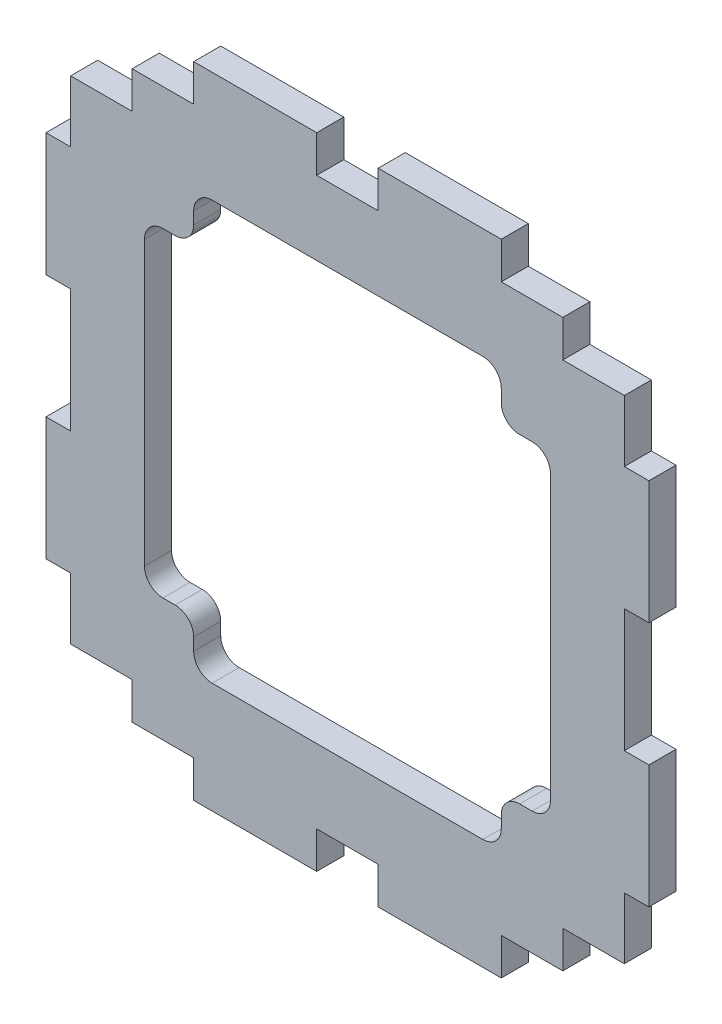
from build123d import *

# Parameters (mm, degrees)
EXTRUDE_1_DEPTH = 2.2


with BuildPart() as part:
    # Model → 凸台-拉伸1 (new body)
    with BuildSketch(Plane.XY):
        Polygon((-11.407474747, -25.191111111), (-11.407474747, -22.191111111), (-16.407474747, -22.191111111), (-16.407474747, -19.191111111), (-21.407474747, -19.191111111), (-21.407474747, -14.191111111), (-23.407474747, -14.191111111), (-23.407474747, -4.191111111), (-21.407474747, -4.191111111), (-21.407474747, 5.808888889), (-23.407474747, 5.808888889), (-23.407474747, 15.808888889), (-21.407474747, 15.808888889), (-21.407474747, 20.808888889), (-16.407474747, 20.808888889), (-16.407474747, 23.808888889), (-11.407474747, 23.808888889), (-11.407474747, 26.808888889), (-1.407474747, 26.808888889), (-1.407474747, 23.808888889), (3.592525253, 23.808888889), (3.592525253, 26.808888889), (13.592525253, 26.808888889), (13.592525253, 23.808888889), (18.592525253, 23.808888889), (18.592525253, 20.808888889), (23.592525253, 20.808888889), (23.592525253, 15.808888889), (25.592525253, 15.808888889), (25.592525253, 5.808888889), (23.592525253, 5.808888889), (23.592525253, -4.191111111), (25.592525253, -4.191111111), (25.592525253, -14.191111111), (23.592525253, -14.191111111), (23.592525253, -19.191111111), (18.592525253, -19.191111111), (18.592525253, -22.191111111), (13.592525253, -22.191111111), (13.592525253, -25.191111111), (3.592525253, -25.191111111), (3.592525253, -22.191111111), (-1.407474747, -22.191111111), (-1.407474747, -25.191111111), align=None)
        with BuildLine():
            Line((16.092525253, 13.808888889), (15.092525253, 13.808888889))
            ThreePointArc((15.092525253, 13.808888889), (14.031865081, 14.248228717), (13.592525253, 15.308888889))
            Line((13.592525253, 15.308888889), (13.592525253, 16.308888889))
            ThreePointArc((13.592525253, 16.308888889), (13.153185424, 17.369549061), (12.092525253, 17.808888889))
            Line((12.092525253, 17.808888889), (-9.907474747, 17.808888889))
            ThreePointArc((-9.907474747, 17.808888889), (-10.968134919, 17.369549061), (-11.407474747, 16.308888889))
            Line((-11.407474747, 16.308888889), (-11.407474747, 15.308888889))
            ThreePointArc((-11.407474747, 15.308888889), (-11.846814576, 14.248228717), (-12.907474747, 13.808888889))
            Line((-12.907474747, 13.808888889), (-13.907474747, 13.808888889))
            ThreePointArc((-13.907474747, 13.808888889), (-14.968134919, 13.369549061), (-15.407474747, 12.308888889))
            Line((-15.407474747, 12.308888889), (-15.407474747, -10.691111111))
            ThreePointArc((-15.407474747, -10.691111111), (-14.968134919, -11.751771283), (-13.907474747, -12.191111111))
            Line((-13.907474747, -12.191111111), (-12.907474747, -12.191111111))
            ThreePointArc((-12.907474747, -12.191111111), (-11.846814576, -12.630450939), (-11.407474747, -13.691111111))
            Line((-11.407474747, -13.691111111), (-11.407474747, -14.691111111))
            ThreePointArc((-11.407474747, -14.691111111), (-10.968134919, -15.751771283), (-9.907474747, -16.191111111))
            Line((-9.907474747, -16.191111111), (12.092525253, -16.191111111))
            ThreePointArc((12.092525253, -16.191111111), (13.153185424, -15.751771283), (13.592525253, -14.691111111))
            Line((13.592525253, -14.691111111), (13.592525253, -13.691111111))
            ThreePointArc((13.592525253, -13.691111111), (14.031865081, -12.630450939), (15.092525253, -12.191111111))
            Line((15.092525253, -12.191111111), (16.092525253, -12.191111111))
            ThreePointArc((16.092525253, -12.191111111), (17.153185424, -11.751771283), (17.592525253, -10.691111111))
            Line((17.592525253, -10.691111111), (17.592525253, 12.308888889))
            ThreePointArc((17.592525253, 12.308888889), (17.153185424, 13.369549061), (16.092525253, 13.808888889))
        make_face(mode=Mode.SUBTRACT)
    extrude(amount=EXTRUDE_1_DEPTH)


solid = part.part
